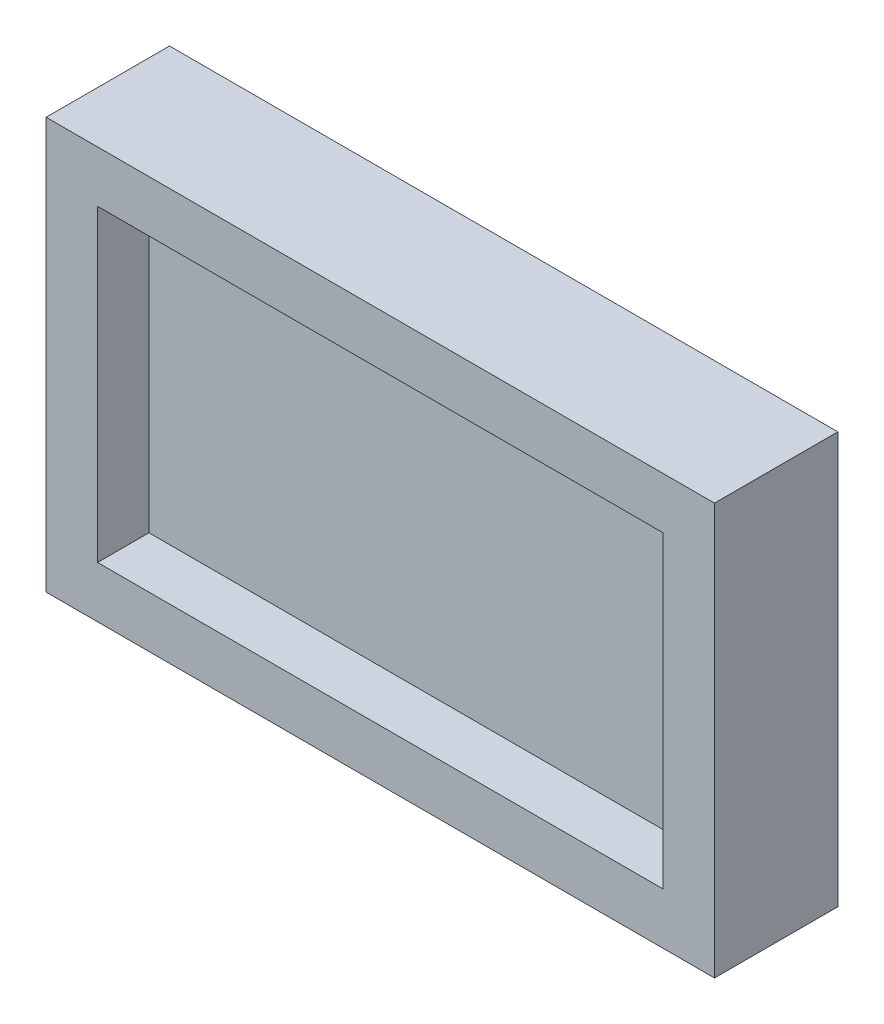
from build123d import *

# Parameters (mm, degrees)
SKETCH_1_W          = 65
SKETCH_1_H          = 40
EXTRUDE_2_DEPTH     = 12
SKETCH_3_W          = 55
SKETCH_3_H          = 30
CUT_EXTRUDE_1_DEPTH = 5


with BuildPart() as part:
    # 草图1 → 凸台-拉伸2 (new body)
    with BuildSketch(Plane.XY):
        with Locations((15.388888889, -5.377777778)):
            Rectangle(SKETCH_1_W, SKETCH_1_H)
    extrude(amount=EXTRUDE_2_DEPTH)

    # 草图3 → 切除-拉伸1 (cut)
    with BuildSketch(Plane.XY.offset(12)):
        with Locations((15.388888889, -5.377777778)):
            Rectangle(SKETCH_3_W, SKETCH_3_H)
    extrude(amount=-CUT_EXTRUDE_1_DEPTH, mode=Mode.SUBTRACT)


solid = part.part
